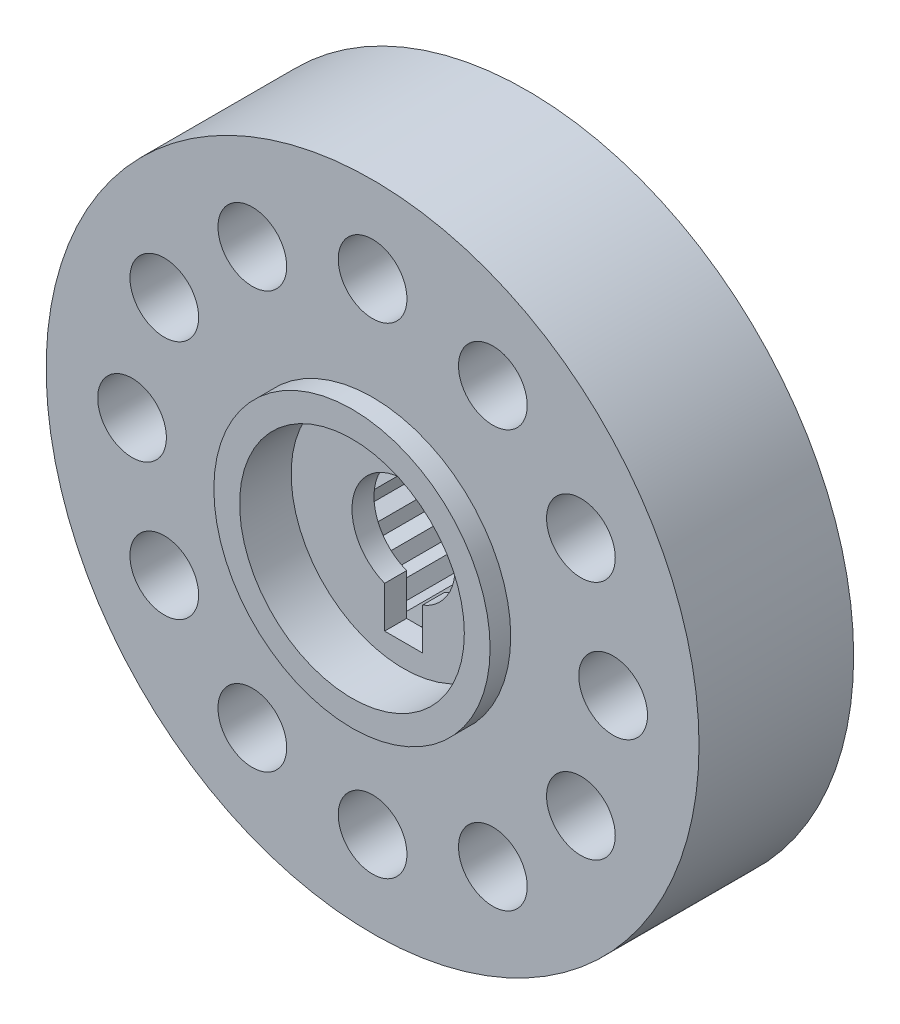
from build123d import *

# Parameters (mm, degrees)
BASE_R                       = 9.5
BODY_DEPTH                   = 4.5
BASE_2_R                     = 4.53
SPLINE_EXTRUSION_BACK_DEPTH  = 1.34
BASE_3_R                     = 4.02
BASE_3_R_2                   = 3.27
SPLINE_EXTRUSION_FRONT_DEPTH = 0.6
FRONT_START                  = -0.9
FRONT_BASE_R                 = 3.27
FRONT_RECESSION_DEPTH        = 0.9
SPLINE_DEPTH                 = 4.3
CENTER_SCREW_HOLE_DEPTH      = 0.64
SCREW_HOLE_SKETCH_R          = 1
SCREW_HOLES_DEPTH            = 15.649423197


with BuildPart() as part:
    # base → body (new body)
    with BuildSketch(Plane.XY):
        Circle(BASE_R)
    extrude(amount=BODY_DEPTH)

    # base 2 → spline extrusion back (add)
    with BuildSketch(Plane(origin=(0, 0, 0), x_dir=(-1, 0, 0), z_dir=(0, 0, -1))):
        with Locations(Location((0, 0, 0), (0, 0, 180))):
            Circle(BASE_2_R)
    extrude(amount=SPLINE_EXTRUSION_BACK_DEPTH)

    # base 3 → spline extrusion front (add)
    with BuildSketch(Plane.XY.offset(4.5)):
        Circle(BASE_3_R)
        Circle(BASE_3_R_2, mode=Mode.SUBTRACT)
    extrude(amount=SPLINE_EXTRUSION_FRONT_DEPTH)

    # front base → front recession (cut)
    with BuildSketch(Plane.XY.offset(4.5).offset(FRONT_START)):
        Circle(FRONT_BASE_R)
    extrude(amount=FRONT_RECESSION_DEPTH, mode=Mode.SUBTRACT)

    # spline profile → spline (cut)
    with BuildSketch(Plane(origin=(0, 0, -1.34), x_dir=(-1, 0, 0), z_dir=(0, 0, -1))):
        Polygon((-0.325866407, 2.579498223), (0, 2.85), (0.325866407, 2.579498223), (0.708766178, 2.760462009), (0.957123837, 2.417418863), (1.372997971, 2.497474038), (1.528241656, 2.103444185), (1.950959252, 2.077560588), (2.003334431, 1.657302373), (2.406334588, 1.527106366), (2.352550336, 1.107026158), (2.710511071, 0.880698434), (2.553946852, 0.487191418), (2.844376176, 0.178952981), (2.594869494, -0.163255351), (2.799518665, -0.534036747), (2.472746942, -0.803444185), (2.5787571, -1.213470981), (2.195252606, -1.393149667), (2.195962742, -1.816658371), (1.779822475, -1.895318431), (1.675187969, -2.305698434), (1.252559553, -2.278397368), (1.049154975, -2.649862985), (0.646593707, -2.518316219), (0.357199716, -2.827526899), (0, -2.6), (-0.357199716, -2.827526899), (-0.646593707, -2.518316219), (-1.049154975, -2.649862985), (-1.252559553, -2.278397368), (-1.675187969, -2.305698434), (-1.779822475, -1.895318431), (-2.195962742, -1.816658371), (-2.195252606, -1.393149667), (-2.5787571, -1.213470981), (-2.472746942, -0.803444185), (-2.799518665, -0.534036747), (-2.594869494, -0.163255351), (-2.844376176, 0.178952981), (-2.553946852, 0.487191418), (-2.710511071, 0.880698434), (-2.352550336, 1.107026158), (-2.406334588, 1.527106366), (-2.003334431, 1.657302373), (-1.950959252, 2.077560588), (-1.528241656, 2.103444185), (-1.372997971, 2.497474038), (-0.957123837, 2.417418863), (-0.708766178, 2.760462009), align=None)
    extrude(amount=-SPLINE_DEPTH, mode=Mode.SUBTRACT)

    # center screw hole sketch → center screw hole (cut)
    with BuildSketch(Plane.XY.offset(3.6)):
        with BuildLine():
            Line((-0.55, -2.6), (0.55, -2.6))
            Line((0.55, -2.6), (0.55, -1.395528574))
            ThreePointArc((0.55, -1.395528574), (0, -1.5), (-0.55, -1.395528574))
            Line((-0.55, -1.395528574), (-0.55, -2.6))
        make_face()
        with BuildLine():
            ThreePointArc((-0.55, -1.395528574), (0, -1.5), (0.55, -1.395528574))
            ThreePointArc((0.55, -1.395528574), (1.239959677, -0.844097151), (1.5, 0))
            ThreePointArc((1.5, 0), (-0.844097151, 1.239959677), (-0.55, -1.395528574))
        make_face()
    extrude(amount=-CENTER_SCREW_HOLE_DEPTH, mode=Mode.SUBTRACT)

    # screw hole sketch → screw holes (cut, through all)
    with BuildSketch(Plane.XY.offset(4.5)):
        with Locations((0, 7)):
            Circle(SCREW_HOLE_SKETCH_R)
        with Locations((3.5, 6.062177826)):
            Circle(SCREW_HOLE_SKETCH_R)
        with Locations((6.062177826, 3.5)):
            Circle(SCREW_HOLE_SKETCH_R)
        with Locations((7, 0)):
            Circle(SCREW_HOLE_SKETCH_R)
        with Locations((6.062177826, -3.5)):
            Circle(SCREW_HOLE_SKETCH_R)
        with Locations((3.5, -6.062177826)):
            Circle(SCREW_HOLE_SKETCH_R)
        with Locations((0, -7)):
            Circle(SCREW_HOLE_SKETCH_R)
        with Locations((-3.5, -6.062177826)):
            Circle(SCREW_HOLE_SKETCH_R)
        with Locations((-6.062177826, -3.5)):
            Circle(SCREW_HOLE_SKETCH_R)
        with Locations((-7, 0)):
            Circle(SCREW_HOLE_SKETCH_R)
        with Locations((-6.062177826, 3.5)):
            Circle(SCREW_HOLE_SKETCH_R)
        with Locations((-3.5, 6.062177826)):
            Circle(SCREW_HOLE_SKETCH_R)
    extrude(amount=-SCREW_HOLES_DEPTH, mode=Mode.SUBTRACT)


solid = part.part
